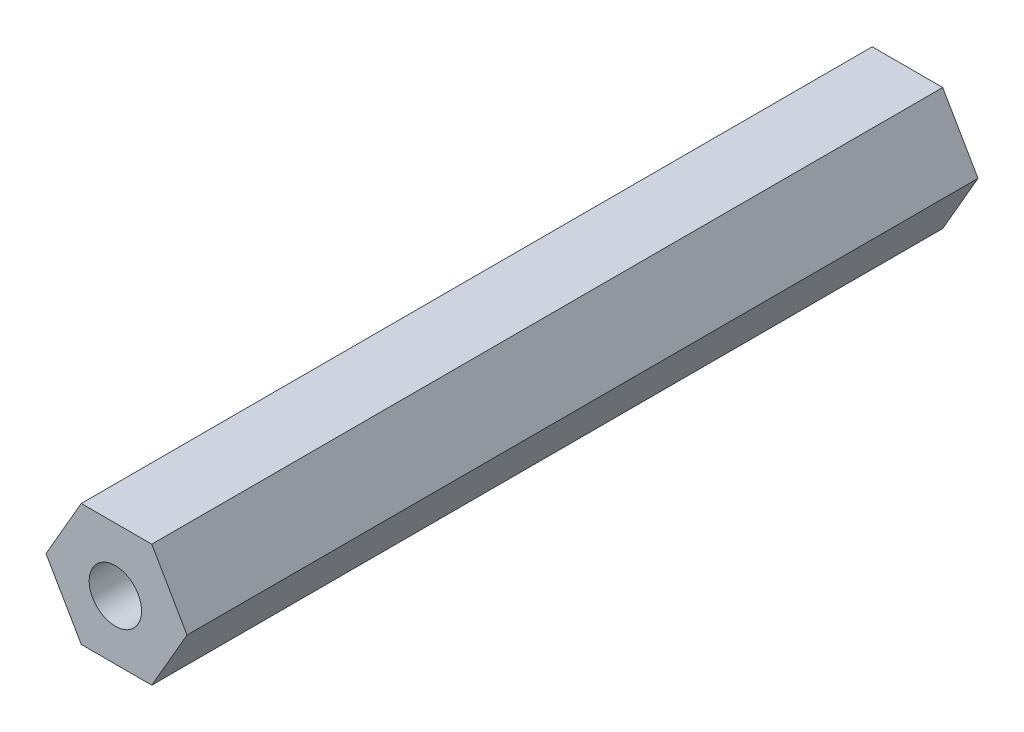
from build123d import *

# Parameters (mm, degrees)
BOSS_EXTRUDE1_DEPTH   = 25.4
F_6_32_TAPPED_HOLE8_D = 2.7051
CHAMFER1_SIZE         = 0.5
CHAMFER2_SIZE         = 0.5
CUT_EXTRUDE2_START    = 25.4
CUT_EXTRUDE2_DEPTH    = 10


with BuildPart() as part:
    # Sketch1 → Boss-Extrude1 (new, symmetric)
    with BuildSketch(Plane.XY):
        Polygon((3.637306696, 0), (1.818653348, 3.15), (-1.818653348, 3.15), (-3.637306696, 0), (-1.818653348, -3.15), (1.818653348, -3.15), align=None)
    extrude(amount=BOSS_EXTRUDE1_DEPTH, both=True)

    # #6-32 Tapped Hole8 (through all)
    with Locations(Plane(origin=(-0.058753338, -0.101763766, 25.4), x_dir=(1, 0, 0), z_dir=(0, 0, 1))):
        with Locations((0, 0)):
            Hole(F_6_32_TAPPED_HOLE8_D / 2)

    # Chamfer1
    chamfer1_edges = [part.edges().sort_by_distance(p)[0] for p in [
        (1.293796662, -0.101763766, 25.4),
    ]]
    chamfer(chamfer1_edges, length=CHAMFER1_SIZE)

    # Chamfer2
    chamfer2_edges = [part.edges().sort_by_distance(p)[0] for p in [
        (1.293796662, -0.101763766, -25.4),
    ]]
    chamfer(chamfer2_edges, length=CHAMFER2_SIZE)

    # Sketch1<2> → Cut-Extrude2 (cut)
    with BuildSketch(Plane.XY.offset(CUT_EXTRUDE2_START)):
        Polygon((3.637306696, 0), (1.818653348, 3.15), (-1.818653348, 3.15), (-3.637306696, 0), (-1.818653348, -3.15), (1.818653348, -3.15), align=None)
    extrude(amount=-CUT_EXTRUDE2_DEPTH, mode=Mode.SUBTRACT)


solid = part.part
